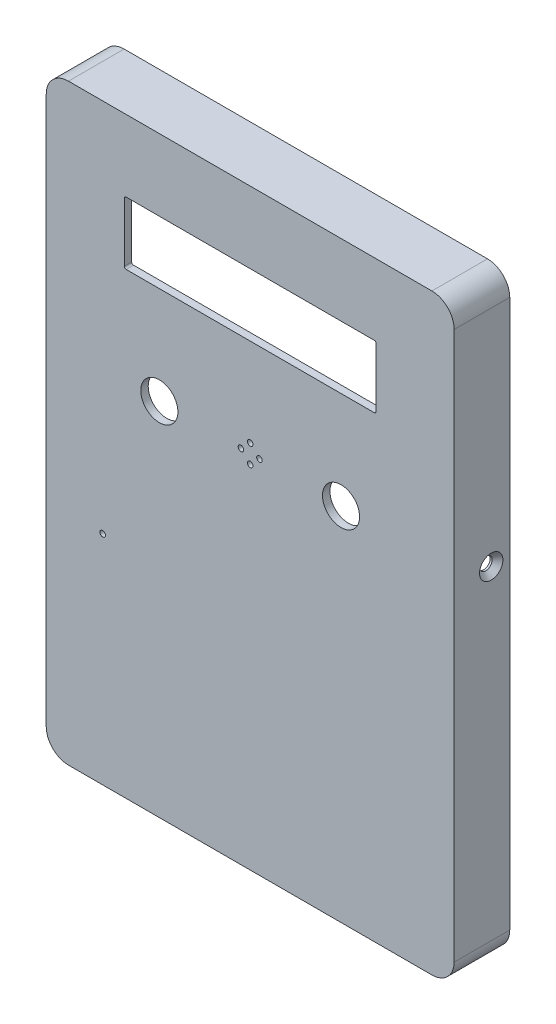
from build123d import *

# Parameters (mm, degrees)
BOSS_EXTRUDE1_DEPTH         = 15
SHELL1_T                    = -2
SKETCH3_R                   = 5
CUT_EXTRUDE1_DEPTH          = 110.402425133
BOSS_EXTRUDE2_REACH         = 110.664
SKETCH4_R                   = 3
BOSS_EXTRUDE2_DRAFT         = 1
M3_TAPPED_HOLE1_D           = 2.5
M3_TAPPED_HOLE1_DEPTH       = 6
M3_TAPPED_HOLE1_CSINK_D     = 3.5
M3_TAPPED_HOLE1_CSINK_ANGLE = 90
M3_TAPPED_HOLE1_TIP         = 0.751075774
SKETCH14_R                  = 0.75
CUT_EXTRUDE3_DEPTH          = 10
SKETCH20_R                  = 0.75
CUT_EXTRUDE4_DEPTH          = 10


with BuildPart() as part:
    # Sketch1 → Boss-Extrude1 (new body)
    with BuildSketch(Plane.XY):
        with BuildLine():
            Line((-49, 66.375), (49, 66.375))
            ThreePointArc((49, 66.375), (53.242640687, 64.617640687), (55, 60.375))
            Line((55, 60.375), (55, -87.375))
            ThreePointArc((55, -87.375), (53.242640687, -91.617640687), (49, -93.375))
            Line((49, -93.375), (-49, -93.375))
            ThreePointArc((-49, -93.375), (-53.242640687, -91.617640687), (-55, -87.375))
            Line((-55, -87.375), (-55, 60.375))
            ThreePointArc((-55, 60.375), (-53.242640687, 64.617640687), (-49, 66.375))
        make_face()
    extrude(amount=BOSS_EXTRUDE1_DEPTH)

    # Shell1
    shell1_openings = [part.faces().sort_by_distance(p)[0] for p in [
        (0, -13.5, 0),
    ]]
    offset(amount=SHELL1_T, openings=shell1_openings, kind=Kind.INTERSECTION)

    # Sketch3 → Cut-Extrude1 (cut, through all)
    with BuildSketch(Plane.XY.offset(15)):
        with Locations((-24.5, 3.875)):
            Circle(SKETCH3_R)
        with Locations((24.5, 3.875)):
            Circle(SKETCH3_R)
        with BuildLine():
            Line((-33.45, 47.075), (33.45, 47.075))
            ThreePointArc((33.45, 47.075), (33.803553391, 46.928553391), (33.95, 46.575))
            Line((33.95, 46.575), (33.95, 30.675))
            ThreePointArc((33.95, 30.675), (33.803553391, 30.321446609), (33.45, 30.175))
            Line((33.45, 30.175), (-33.45, 30.175))
            ThreePointArc((-33.45, 30.175), (-33.803553391, 30.321446609), (-33.95, 30.675))
            Line((-33.95, 30.675), (-33.95, 46.575))
            ThreePointArc((-33.95, 46.575), (-33.803553391, 46.928553391), (-33.45, 47.075))
        make_face()
    extrude(amount=-CUT_EXTRUDE1_DEPTH, mode=Mode.SUBTRACT)




with BuildPart() as boss_extrude2_long_prism_1:
    # Sketch4 → Boss-Extrude2 (the long prism of profile 1, to be tilted and cut off)
    with BuildSketch(Plane(origin=(0, 0, 7), x_dir=(-1, 0, 0), z_dir=(0, 0, -1))):
        with Locations((-45, 56.375)):
            Circle(SKETCH4_R)
    extrude(amount=-BOSS_EXTRUDE2_REACH)
    boss_extrude2_tool1_sides = [boss_extrude2_long_prism_1.faces().sort_by_distance(p)[0] for p in [
        (48, 56.375, 62.332),
    ]]
    draft(boss_extrude2_tool1_sides, Plane(origin=(0, 0, 7), x_dir=(-1, 0, 0), z_dir=(0, 0, -1)), BOSS_EXTRUDE2_DRAFT)  # the draft: side faces tilted about the start plane


with BuildPart() as part_1:
    add(part.part)
    boss_extrude2_tool1 = boss_extrude2_long_prism_1.part - part.part



with BuildPart() as boss_extrude2_long_prism_2:
    # Sketch4 → Boss-Extrude2 (the long prism of profile 2, to be tilted and cut off)
    with BuildSketch(Plane(origin=(0, 0, 7), x_dir=(-1, 0, 0), z_dir=(0, 0, -1))):
        with Locations((-45, -56.375)):
            Circle(SKETCH4_R)
    extrude(amount=-BOSS_EXTRUDE2_REACH)
    boss_extrude2_tool2_sides = [boss_extrude2_long_prism_2.faces().sort_by_distance(p)[0] for p in [
        (48, -56.375, 62.332),
    ]]
    draft(boss_extrude2_tool2_sides, Plane(origin=(0, 0, 7), x_dir=(-1, 0, 0), z_dir=(0, 0, -1)), BOSS_EXTRUDE2_DRAFT)  # the draft: side faces tilted about the start plane


with BuildPart() as part_2:
    add(part_1.part)
    boss_extrude2_tool2 = boss_extrude2_long_prism_2.part - part.part



with BuildPart() as boss_extrude2_long_prism_3:
    # Sketch4 → Boss-Extrude2 (the long prism of profile 3, to be tilted and cut off)
    with BuildSketch(Plane(origin=(0, 0, 7), x_dir=(-1, 0, 0), z_dir=(0, 0, -1))):
        with Locations((45, 56.375)):
            Circle(SKETCH4_R)
    extrude(amount=-BOSS_EXTRUDE2_REACH)
    boss_extrude2_tool3_sides = [boss_extrude2_long_prism_3.faces().sort_by_distance(p)[0] for p in [
        (-42, 56.375, 62.332),
    ]]
    draft(boss_extrude2_tool3_sides, Plane(origin=(0, 0, 7), x_dir=(-1, 0, 0), z_dir=(0, 0, -1)), BOSS_EXTRUDE2_DRAFT)  # the draft: side faces tilted about the start plane


with BuildPart() as part_3:
    add(part_2.part)
    boss_extrude2_tool3 = boss_extrude2_long_prism_3.part - part.part



with BuildPart() as boss_extrude2_long_prism_4:
    # Sketch4 → Boss-Extrude2 (the long prism of profile 4, to be tilted and cut off)
    with BuildSketch(Plane(origin=(0, 0, 7), x_dir=(-1, 0, 0), z_dir=(0, 0, -1))):
        with Locations((45, -56.375)):
            Circle(SKETCH4_R)
    extrude(amount=-BOSS_EXTRUDE2_REACH)
    boss_extrude2_tool4_sides = [boss_extrude2_long_prism_4.faces().sort_by_distance(p)[0] for p in [
        (-42, -56.375, 62.332),
    ]]
    draft(boss_extrude2_tool4_sides, Plane(origin=(0, 0, 7), x_dir=(-1, 0, 0), z_dir=(0, 0, -1)), BOSS_EXTRUDE2_DRAFT)  # the draft: side faces tilted about the start plane


with BuildPart() as part_4:
    add(part_3.part)
    boss_extrude2_tool4 = boss_extrude2_long_prism_4.part - part.part
    add(boss_extrude2_tool1.solids().sort_by_distance((45, 56.375, 7))[0])
    add(boss_extrude2_tool2.solids().sort_by_distance((45, -56.375, 7))[0])
    add(boss_extrude2_tool3.solids().sort_by_distance((-45, 56.375, 7))[0])
    add(boss_extrude2_tool4.solids().sort_by_distance((-45, -56.375, 7))[0])

    # M3 Tapped Hole1
    with Locations(Plane(origin=(0, 0, 7), x_dir=(-1, 0, 0), z_dir=(0, 0, -1))):
        with Locations((-45, 56.375), (45, 56.375), (45, -56.375), (-45, -56.375)):
            CounterSinkHole(M3_TAPPED_HOLE1_D / 2, M3_TAPPED_HOLE1_CSINK_D / 2, depth=M3_TAPPED_HOLE1_DEPTH, counter_sink_angle=M3_TAPPED_HOLE1_CSINK_ANGLE)
            with Locations((0, 0, -(M3_TAPPED_HOLE1_DEPTH + M3_TAPPED_HOLE1_TIP / 2))):  # 118° drill point
                Cone(0, M3_TAPPED_HOLE1_D / 2, M3_TAPPED_HOLE1_TIP, mode=Mode.SUBTRACT)

    # Sketch14 → Cut-Extrude3 (cut)
    with BuildSketch(Plane.XY.offset(15)):
        with Locations((0, 6.375)):
            Circle(SKETCH14_R)
        with Locations((0, 1.375)):
            Circle(SKETCH14_R)
        with Locations((2.5, 3.875)):
            Circle(SKETCH14_R)
        with Locations((-2.5, 3.875)):
            Circle(SKETCH14_R)
    extrude(amount=-CUT_EXTRUDE3_DEPTH, mode=Mode.SUBTRACT)

    # Sketch17 → CSK for M3 Countersunk Flat Head Screw1 (revolve, cut)
    with BuildSketch(Plane(origin=(-55, 0, 5), x_dir=(0, 0, 1), z_dir=(0, 1, 0))):
        Polygon((0, 0), (0, 2), (1.7, 2), (1.7, 1.45), (3.15, 0), align=None)
    revolve(axis=Axis((-61.35, 0, 5), (1, 0, 0)), mode=Mode.SUBTRACT)

    # Sketch19 → CSK SLOT for M3 Countersunk Flat Head Screw1 (revolve, cut)
    with BuildSketch(Plane(origin=(55, 0, 5), x_dir=(0, 0, -1), z_dir=(0, 1, 0))):
        Polygon((0, 0), (0, 2), (1.7, 2), (1.7, 1.45), (3.15, 0), align=None)
    revolve(axis=Axis((61.35, 0, 5), (-1, 0, 0)), mode=Mode.SUBTRACT)

    # Sketch20 → Cut-Extrude4 (cut)
    with BuildSketch(Plane.XY.offset(15)):
        with Locations((-39.79, -34.725)):
            Circle(SKETCH20_R)
    extrude(amount=-CUT_EXTRUDE4_DEPTH, mode=Mode.SUBTRACT)


solid = part_4.part
